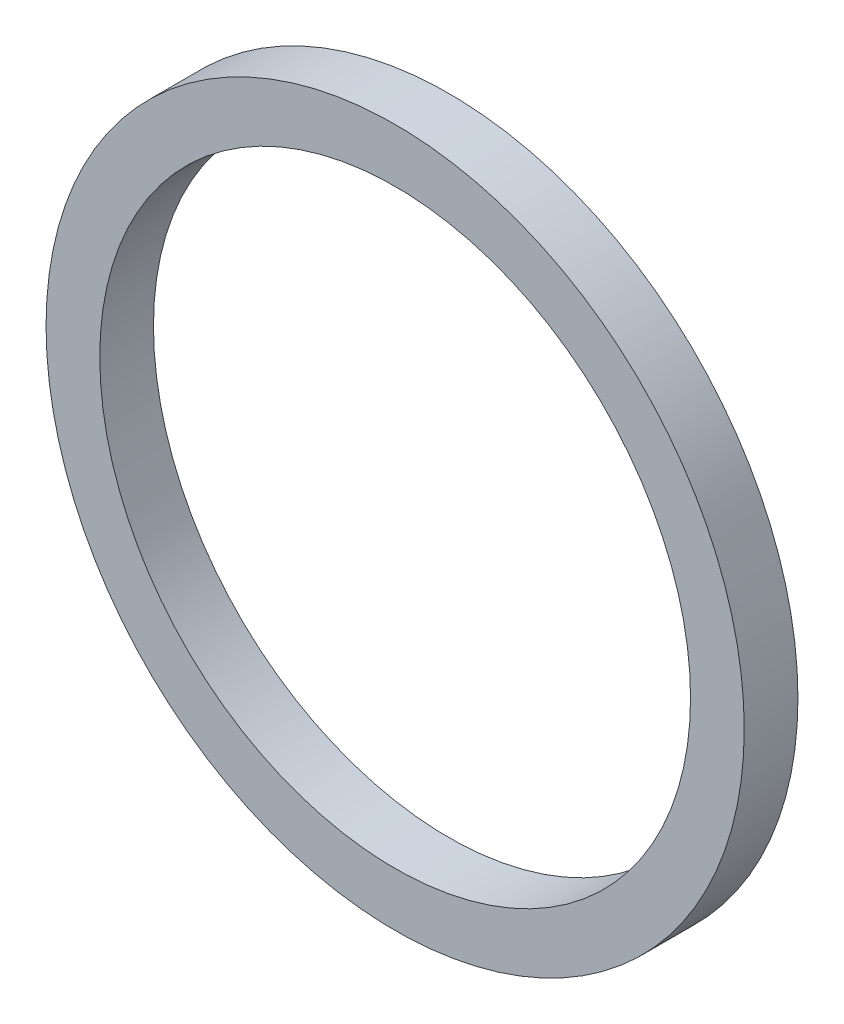
from build123d import *

# Parameters (mm, degrees)
SKETCH2_R           = 32.5
BOSS_EXTRUDE1_DEPTH = 2.5
SKETCH3_R           = 27.5
CUT_EXTRUDE1_DEPTH  = 5


with BuildPart() as part:
    # Sketch2 → Boss-Extrude1 (new, symmetric)
    with BuildSketch(Plane.XY):
        Circle(SKETCH2_R)
    extrude(amount=BOSS_EXTRUDE1_DEPTH, both=True)

    # Sketch3 → Cut-Extrude1 (cut)
    with BuildSketch(Plane.XY.offset(2.5)):
        Circle(SKETCH3_R)
    extrude(amount=-CUT_EXTRUDE1_DEPTH, mode=Mode.SUBTRACT)


solid = part.part
